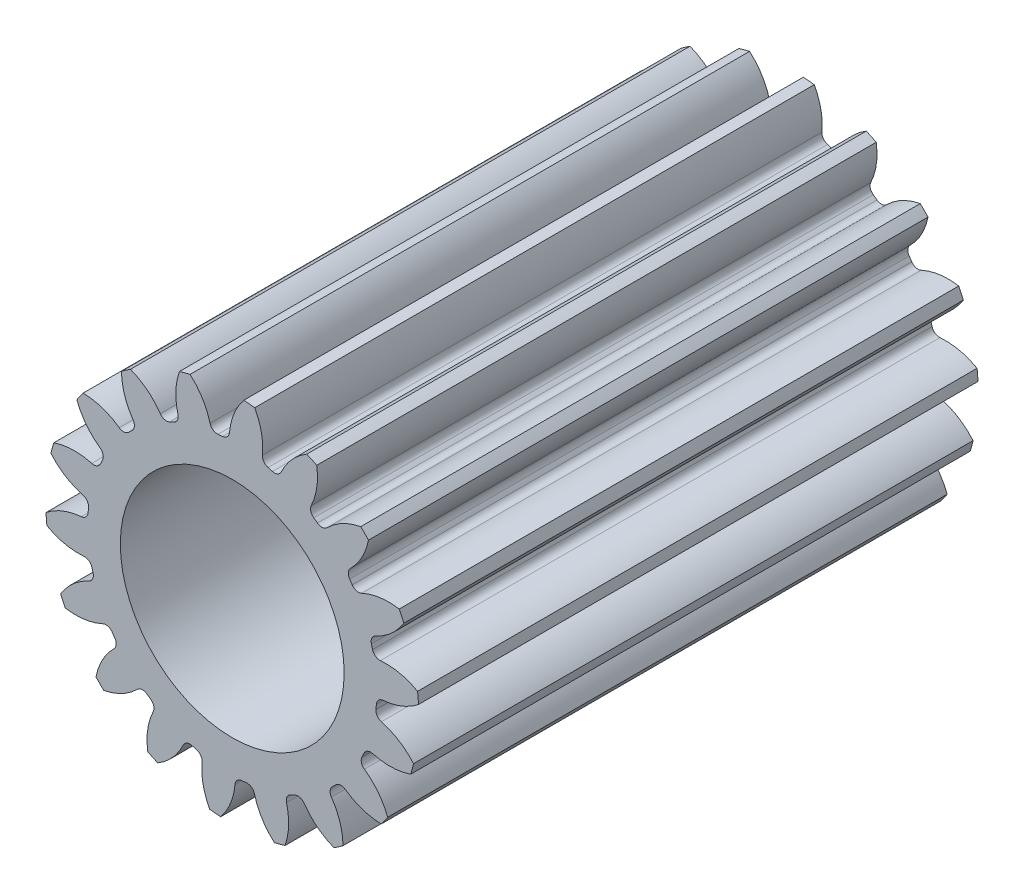
from build123d import *

# Parameters (mm, degrees)
SKETCH3_R         = 10
GEARBODY_DEPTH    = 30
TOOTHCUT_DEPTH    = 34.166247904
CIRPATTERN1_COUNT = 18
BOREDIA_R         = 6
BORE_DEPTH        = 12700


with BuildPart() as part:
    # Sketch3 → gearBody (new body)
    with BuildSketch(Plane.XY):
        Circle(SKETCH3_R)
    extrude(amount=GEARBODY_DEPTH)

    # Sketch2 → toothCut (cut, through all)
    with BuildSketch(Plane.XY):
        with BuildLine():
            ThreePointArc((7.704668355, -0.829569873), (7.716788796, -0.708005165), (7.726991303, -0.586264488))
            ThreePointArc((7.726991303, -0.586264488), (7.842107939, -0.334801684), (8.092991452, -0.218427957))
            ThreePointArc((8.092991452, -0.218427957), (9.555163779, 0.239652395), (10.676979571, 1.283354868))
            ThreePointArc((10.676979571, 1.283354868), (10.708853382, -0.982523133), (10.265199855, -3.204772129))
            ThreePointArc((10.265199855, -3.204772129), (9.352030842, -1.974362491), (7.997624499, -1.257864773))
            ThreePointArc((7.997624499, -1.257864773), (7.772105527, -1.097781748), (7.704668355, -0.829569873))
        make_face()
    toothcut = extrude(amount=TOOTHCUT_DEPTH, mode=Mode.SUBTRACT)

    # CirPattern1: toothCut ×18 about axis
    cirpattern1_axis = Axis((0, 0, 30), (0, 0, -1))
    for i in range(1, CIRPATTERN1_COUNT):
        add(toothcut.rotate(cirpattern1_axis, i * 360 / CIRPATTERN1_COUNT), mode=Mode.SUBTRACT)

    # boreDia → bore (cut, symmetric)
    with BuildSketch(Plane.XY):
        Circle(BOREDIA_R)
    extrude(amount=BORE_DEPTH, both=True, mode=Mode.SUBTRACT)


solid = part.part
